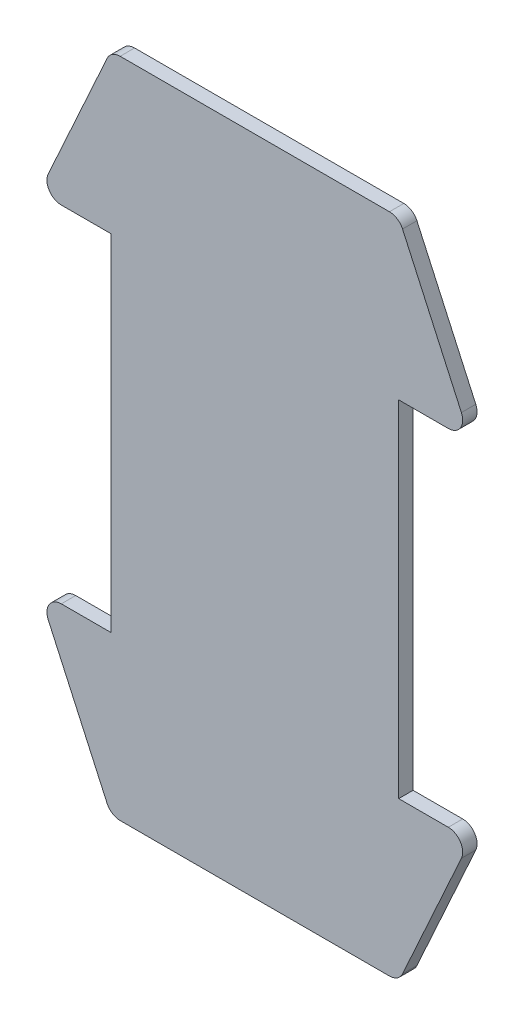
from build123d import *

# Parameters (mm, degrees)
BOSS_EXTRUDE1_DEPTH = 5
FILLET2_R           = 5


with BuildPart() as part:
    # Sketch3 → Boss-Extrude1 (new body)
    with BuildSketch(Plane.XY):
        Polygon((50, 115), (-50, 115), (-75, 60), (-50, 60), (-50, -60), (-75, -60), (-50, -115), (50, -115), (75, -60), (50, -60), (50, 60), (75, 60), align=None)
    extrude(amount=-BOSS_EXTRUDE1_DEPTH)

    # Fillet2
    fillet2_edges = [part.edges().sort_by_distance(p)[0] for p in [
        (-50, 115, -2.5),
        (50, 115, -2.5),
        (75, 60, -2.5),
        (75, -60, -2.5),
        (50, -115, -2.5),
        (-50, -115, -2.5),
        (-75, -60, -2.5),
        (-75, 60, -2.5),
    ]]
    fillet(fillet2_edges, radius=FILLET2_R)


solid = part.part
